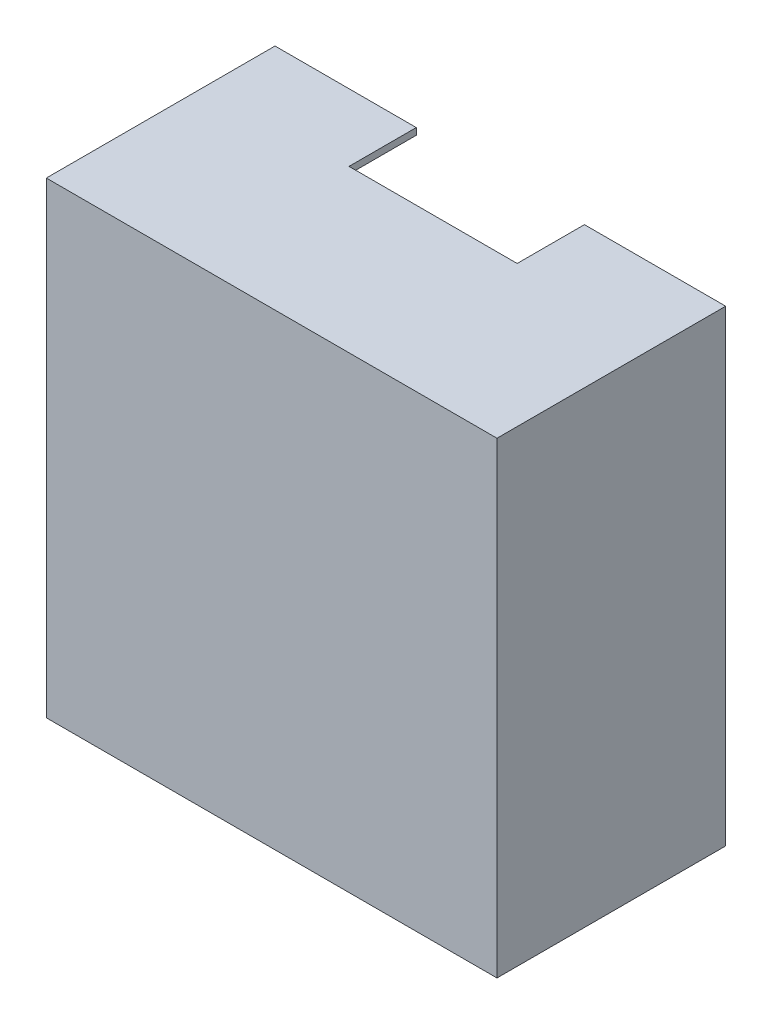
from build123d import *

# Parameters (mm, degrees)
SKETCH_1_W          = 268
SKETCH_1_H          = 136
EXTRUDE_1_DEPTH     = 278
SKETCH_2_W          = 260
SKETCH_2_H          = 270
CUT_EXTRUDE_1_DEPTH = 134
CUT_EXTRUDE_2_REACH = 318.013
SKETCH_3_W          = 100
SKETCH_3_H          = 40


with BuildPart() as part:
    # 草图1 → 凸台-拉伸1 (new body)
    with BuildSketch(Plane(origin=(0, 0, 0), x_dir=(1, 0, 0), z_dir=(0, 1, 0))):
        Rectangle(SKETCH_1_W, SKETCH_1_H)
    extrude(amount=EXTRUDE_1_DEPTH)

    # 草图2 → 切除-拉伸1 (cut)
    with BuildSketch(Plane(origin=(0, 0, -68), x_dir=(-1, 0, 0), z_dir=(0, 0, -1))):
        with Locations((0, 139)):
            Rectangle(SKETCH_2_W, SKETCH_2_H)
    extrude(amount=-CUT_EXTRUDE_1_DEPTH, mode=Mode.SUBTRACT)

    # 草图3 → 切除-拉伸2 (cut, up to next)
    with BuildSketch(Plane(origin=(0, 278, 0), x_dir=(1, 0, 0), z_dir=(0, 1, 0)), mode=Mode.PRIVATE) as cut_extrude_2_sk1:
        with Locations((0, 48)):
            Rectangle(SKETCH_3_W, SKETCH_3_H)
    cut_extrude_2_tool1 = extrude(cut_extrude_2_sk1.sketch, amount=-CUT_EXTRUDE_2_REACH, mode=Mode.PRIVATE) & part.part
    add(cut_extrude_2_tool1.solids().sort_by_distance((0, 278, -48))[0], mode=Mode.SUBTRACT)


solid = part.part
